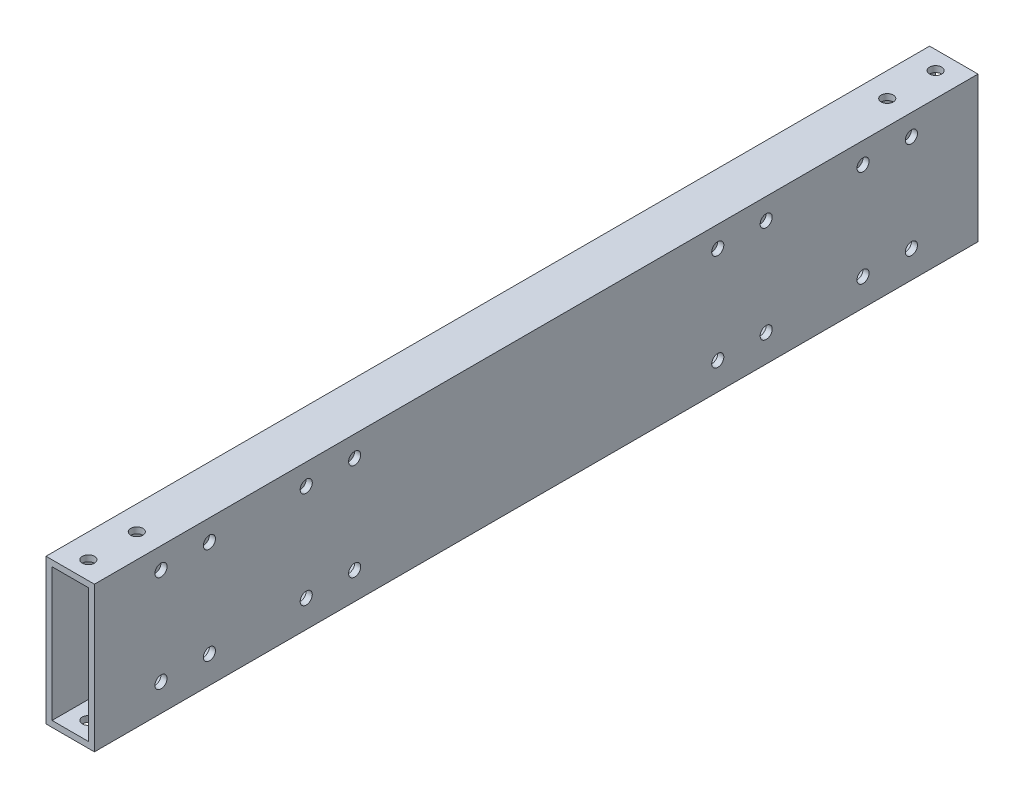
from build123d import *

# Parameters (mm, degrees)
SKETCH1_W                   = 25.4
SKETCH1_H                   = 76.2
SKETCH1_W_2                 = 19.05
SKETCH1_H_2                 = 69.85
BOSS_EXTRUDE3_DEPTH         = 463.55
SKETCH6_R                   = 3.175
CUT_EXTRUDE1_DEPTH          = 806.45
F_1_4_0_25_DIAMETER_HOLE1_D = 6.35
F_1_4_0_25_DIAMETER_HOLE2_D = 6.35
F_1_4_0_25_DIAMETER_HOLE3_D = 6.35


with BuildPart() as part:
    # Sketch1 → Boss-Extrude3 (new body)
    with BuildSketch(Plane.XY):
        Rectangle(SKETCH1_W, SKETCH1_H)
        Rectangle(SKETCH1_W_2, SKETCH1_H_2, mode=Mode.SUBTRACT)
    extrude(amount=BOSS_EXTRUDE3_DEPTH)

    # Sketch6 → Cut-Extrude1 (cut)
    with BuildSketch(Plane(origin=(0, -38.1, 0), x_dir=(-1, 0, 0), z_dir=(0, -1, 0))):
        with Locations(Location((0, -9.525, 0), (0, 0, 180))):
            Circle(SKETCH6_R)
        with Locations(Location((0, -34.925, 0), (0, 0, 180))):
            Circle(SKETCH6_R)
        with Locations(Location((0, -454.025, 0), (0, 0, 180))):
            Circle(SKETCH6_R)
        with Locations(Location((0, -428.625, 0), (0, 0, 180))):
            Circle(SKETCH6_R)
    extrude(amount=-CUT_EXTRUDE1_DEPTH, mode=Mode.SUBTRACT)

    # 1/4 (0.25) Diameter Hole1 (through all)
    with Locations(Plane.ZY.offset(12.7)):
        with Locations((136.525, 27.051), (111.125, 27.051), (136.525, -23.749), (111.125, -23.749), (327.025, 27.051), (352.425, 27.051), (327.025, -23.749), (352.425, -23.749)):
            Hole(F_1_4_0_25_DIAMETER_HOLE1_D / 2)

    # 1/4 (0.25) Diameter Hole2 (through all)
    with Locations(Plane.ZY.offset(12.7)):
        with Locations((34.925, 27.051), (60.325, 27.051), (34.925, -23.749), (60.325, -23.749)):
            Hole(F_1_4_0_25_DIAMETER_HOLE2_D / 2)

    # 1/4 (0.25) Diameter Hole3 (through all)
    with Locations(Plane.ZY.offset(12.7)):
        with Locations((403.225, 27.051), (428.625, 27.051), (403.225, -23.749), (428.625, -23.749)):
            Hole(F_1_4_0_25_DIAMETER_HOLE3_D / 2)


solid = part.part
